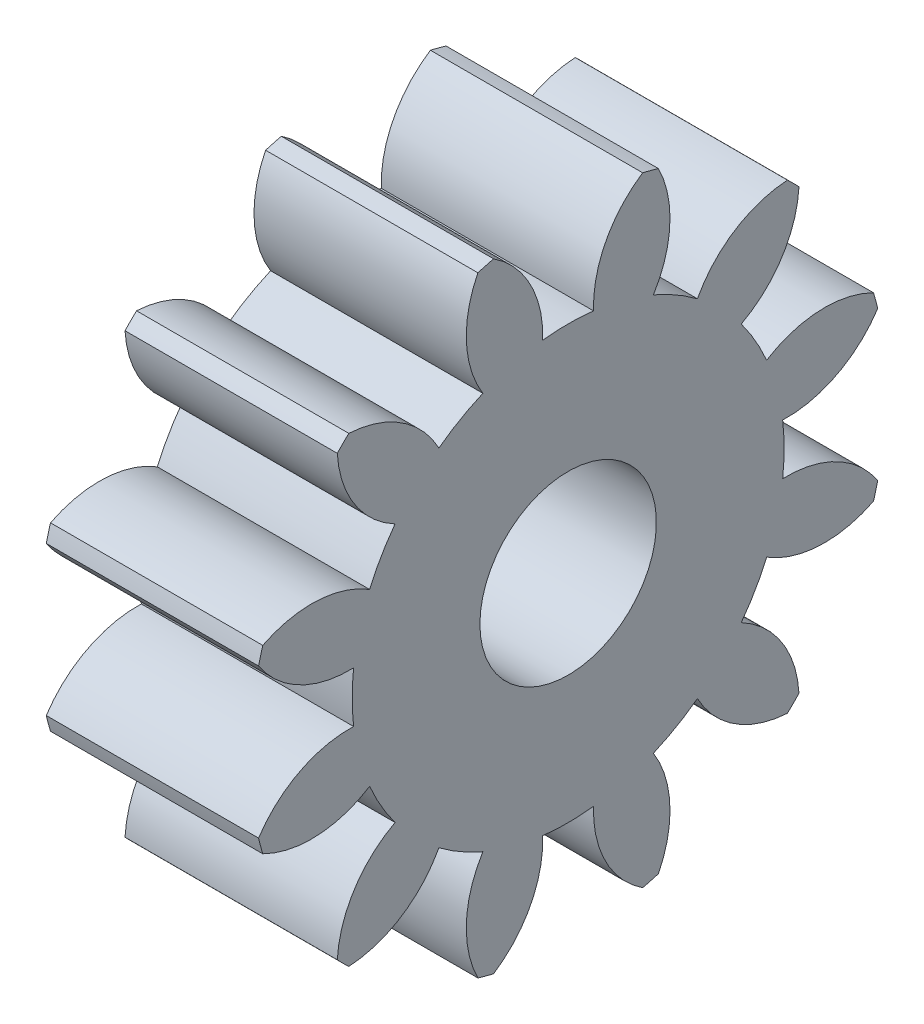
from build123d import *

# Parameters (mm, degrees)
BASPROSKE_W             = 7
BASPROSKE_H             = 10.5
TOOTHCUT_DEPTH          = 17.416455159
TEETHCUTS_COUNT         = 12
TEETHCUTS_ANGLE         = 330
BORSKE_R                = 2.5
BORE_DEPTH              = 50.0000508
CROQUIS2_R              = 2.91
CORTAR_EXTRUIR1_DEPTH   = 11
CROQUIS3_R              = 3.252376505
CROQUIS3_R_2            = 1.9
SALIENTE_EXTRUIR2_DEPTH = 0.79


with BuildPart() as part:
    # BasProSke → Base-Revolve (revolve)
    with BuildSketch(Plane(origin=(0, 0, 0), x_dir=(1, 0, 0), z_dir=(0, 1, 0)), mode=Mode.PRIVATE) as base_revolve_sk:
        with Locations((3.5, 5.25)):
            Rectangle(BASPROSKE_W, BASPROSKE_H)
    revolve(base_revolve_sk.sketch.rotate(Axis((-10, 0, 0), (1, 0, 0)), 180), axis=Axis((-10, 0, 0), (1, 0, 0)))

    # TooCutSke → ToothCut (cut, through all)
    with BuildSketch(Plane(origin=(0, 0, 0), x_dir=(0, 0, -1), z_dir=(1, 0, 0))):
        with BuildLine():
            ThreePointArc((0.837751456, 7.074570552), (0, 7.124), (-0.837751456, 7.074570552))
            ThreePointArc((-0.837751456, 7.074570552), (-1.245380016, 8.868946541), (-2.486473743, 10.227487154))
            ThreePointArc((-2.486473743, 10.227487154), (0, 10.5254), (2.486473743, 10.227487154))
            ThreePointArc((2.486473743, 10.227487154), (1.245380016, 8.868946541), (0.837751456, 7.074570552))
        make_face()
    toothcut = extrude(amount=TOOTHCUT_DEPTH, mode=Mode.SUBTRACT)

    # TeethCuts: ToothCut ×12 about axis
    teethcuts_axis = Axis((-10, 0, 0), (1, 0, 0))
    for i in range(1, TEETHCUTS_COUNT):
        add(toothcut.rotate(teethcuts_axis, i * TEETHCUTS_ANGLE / (TEETHCUTS_COUNT - 1)), mode=Mode.SUBTRACT)

    # BorSke → Bore (cut, symmetric)
    with BuildSketch(Plane(origin=(0, 0, 0), x_dir=(0, 0, -1), z_dir=(1, 0, 0))):
        with Locations(Location((0, 0, 0), (0, 0, 180))):
            Circle(BORSKE_R)
    extrude(amount=BORE_DEPTH, both=True, mode=Mode.SUBTRACT)

    # Croquis2 → Cortar-Extruir1 (cut)
    with BuildSketch(Plane.ZY):
        Circle(CROQUIS2_R)
    extrude(amount=-CORTAR_EXTRUIR1_DEPTH, mode=Mode.SUBTRACT)

    # Croquis3 → Saliente-Extruir2 (add, symmetric)
    with BuildSketch(Plane(origin=(1, 0, 0), x_dir=(0, 0, -1), z_dir=(1, 0, 0))):
        Circle(CROQUIS3_R)
        with Locations(Location((0, 0, 0), (0, 0, 180))):
            Circle(CROQUIS3_R_2, mode=Mode.SUBTRACT)
    extrude(amount=SALIENTE_EXTRUIR2_DEPTH, both=True)


solid = part.part
